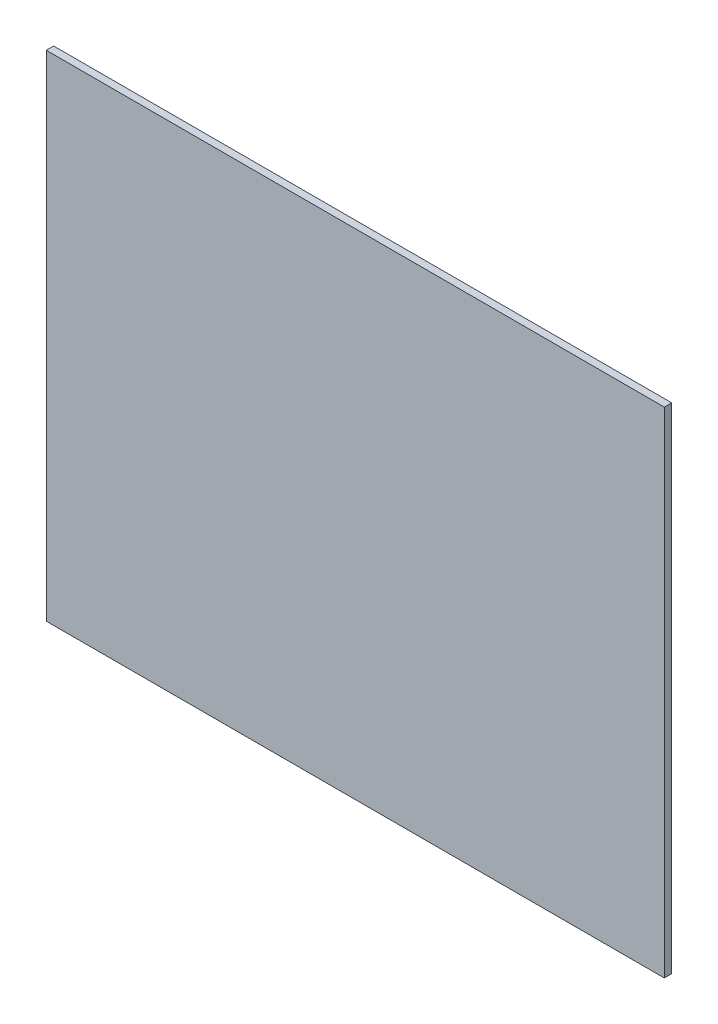
from build123d import *

# Parameters (mm, degrees)
SKETCH1_W           = 500
SKETCH1_H           = 400
BOSS_EXTRUDE1_DEPTH = 6


with BuildPart() as part:
    # Sketch1 → Boss-Extrude1 (new body)
    with BuildSketch(Plane.XY):
        with Locations((250, -200)):
            Rectangle(SKETCH1_W, SKETCH1_H)
    extrude(amount=BOSS_EXTRUDE1_DEPTH)


solid = part.part
